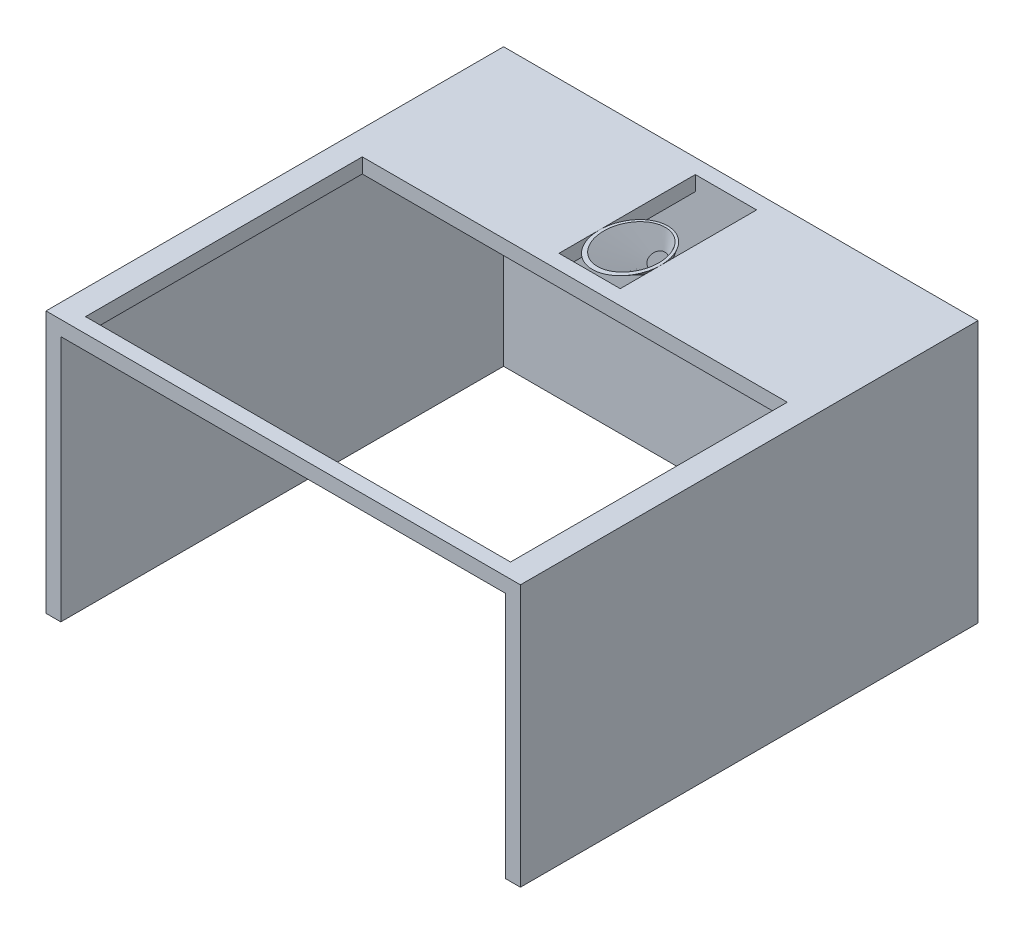
from build123d import *

# Parameters (mm, degrees)
SKETCH1_W               = 96
SKETCH1_H               = 62
SKETCH1_W_2             = 86
SKETCH1_H_2             = 56
BOSS_EXTRUDE1_DEPTH     = 3
CUT_EXTRUDE1_DEPTH      = 80.713392874
CUT_EXTRUDE1_DEPTH_BACK = 80.713392874
SKETCH6_W               = 96
SKETCH6_H               = 13.293726608
SKETCH8_W               = 41.800696096
SKETCH8_H               = 3
BOSS_EXTRUDE2_DEPTH     = 27.592766
SKETCH9_W               = 41.800696096
SKETCH9_H               = 3
SKETCH9_W_2             = 12.398607808
BOSS_EXTRUDE3_DEPTH     = 3
BOSS_EXTRUDE4_DEPTH     = 50


with BuildPart() as part:
    # Sketch1 → Boss-Extrude1 (new body)
    with BuildSketch(Plane(origin=(0, 0, 0), x_dir=(1, 0, 0), z_dir=(0, 1, 0))):
        Rectangle(SKETCH1_W, SKETCH1_H)
        Rectangle(SKETCH1_W_2, SKETCH1_H_2, mode=Mode.SUBTRACT)
    extrude(amount=BOSS_EXTRUDE1_DEPTH)

    # Sketch8 → Boss-Extrude2 (add)
    with BuildSketch(Plane(origin=(0, 0, -31), x_dir=(-1, 0, 0), z_dir=(0, 0, -1))):
        with Locations((-27.099651952, 1.5)):
            Rectangle(SKETCH8_W, SKETCH8_H)
        with Locations((27.099651952, 1.5)):
            Rectangle(SKETCH8_W, SKETCH8_H)
    extrude(amount=BOSS_EXTRUDE2_DEPTH)


with BuildPart() as body_2:
    # Sketch5 → Revolve4 (revolve)
    with BuildSketch(Plane(origin=(0, 0, 0), x_dir=(0, 0, -1), z_dir=(1, 0, 0))):
        Polygon((42.847766111, -3.264000825), (43.35293319, -2.972342476), (32.435517398, 3.079279916), (29.397254743, 4.191739373), align=None)
    revolve(axis=Axis((0, -3.698755296, -45.694749278), (0, 0.8660254037844369, 0.500000000000003)))

    # Sketch6 → Cut-Extrude1 (cut, two sides: drawn at the far end of the back side and taken through both)
    with BuildSketch(Plane(origin=(0, 0, -31), x_dir=(-1, 0, 0), z_dir=(0, 0, -1)).offset(-CUT_EXTRUDE1_DEPTH_BACK)):
        with Locations((0, 9.646863304)):
            Rectangle(SKETCH6_W, SKETCH6_H)
    extrude(amount=CUT_EXTRUDE1_DEPTH + CUT_EXTRUDE1_DEPTH_BACK, mode=Mode.SUBTRACT)


with BuildPart() as boss_extrude3_tool:
    # Sketch9 → Boss-Extrude3 (new body)
    with BuildSketch(Plane(origin=(0, 0, -58.59276647), x_dir=(-1, 0, 0), z_dir=(0, 0, -1))):
        with Locations((27.099651952, 1.5)):
            Rectangle(SKETCH9_W, SKETCH9_H)
        with Locations((0, 1.5)):
            Rectangle(SKETCH9_W_2, SKETCH9_H)
        with Locations((-27.099651952, 1.5)):
            Rectangle(SKETCH9_W, SKETCH9_H)
    extrude(amount=BOSS_EXTRUDE3_DEPTH)


with BuildPart() as part_1:
    add(part.part)


with BuildPart() as part_2:
    # Boss-Extrude3: joined with boss_extrude3_tool
    add(part_1.part.fuse(boss_extrude3_tool.part, tol=0.00001))

    # Sketch10 → Boss-Extrude4 (add)
    with BuildSketch(Plane.XZ):
        Polygon((48, -61.59276647), (48, 31), (45, 31), (45, -58.59276647), (-45, -58.59276647), (-45, 31), (-48, 31), (-48, -61.59276647), align=None)
    extrude(amount=BOSS_EXTRUDE4_DEPTH)


solid = Compound([body_2.part, part_2.part])
